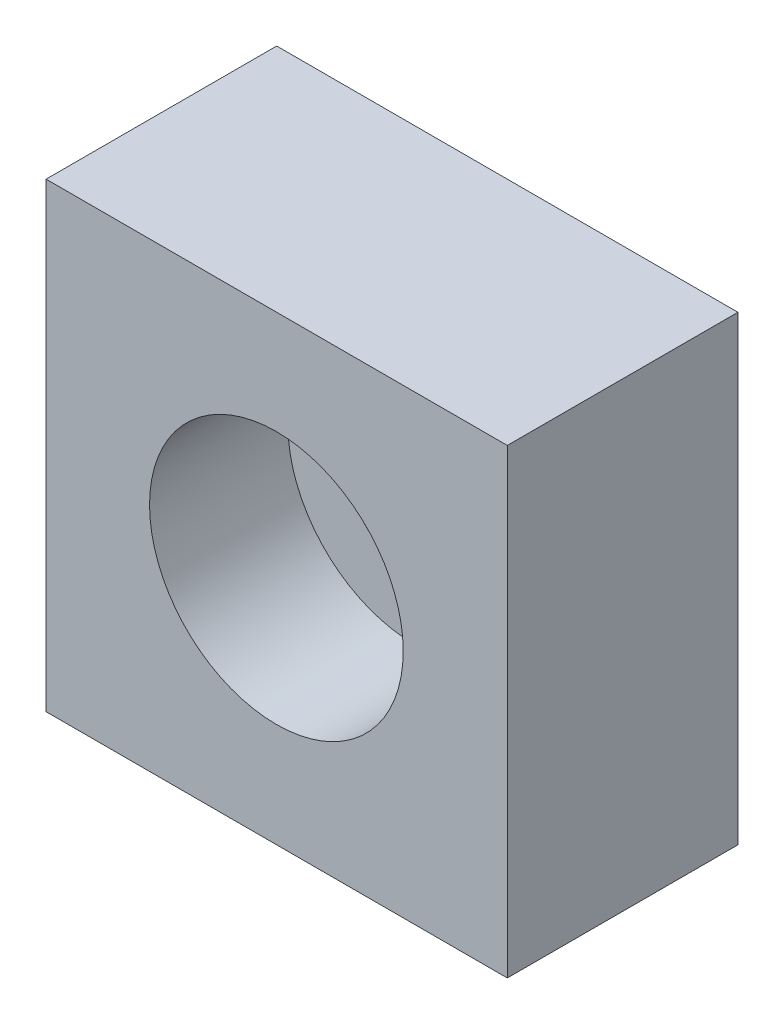
from build123d import *

# Parameters (mm, degrees)
SKETCH_1_W                             = 20
SKETCH_1_H                             = 20
BASEBOX_DEPTH                          = 10
HOLE_BLINDCBORE_THRU_DEPTH_D           = 6
HOLE_BLINDCBORE_THRU_DEPTH_CBORE_D     = 11
HOLE_BLINDCBORE_THRU_DEPTH_CBORE_DEPTH = 6


with BuildPart() as part:
    # 草图1 → BaseBox (new body)
    with BuildSketch(Plane.XY):
        with Locations((10, 10)):
            Rectangle(SKETCH_1_W, SKETCH_1_H)
    extrude(amount=BASEBOX_DEPTH)

    # Hole_BlindCbore_thru_depth (through all)
    with Locations(Plane.XY.offset(10)):
        with Locations((9.986487375, 10.014305599)):
            CounterBoreHole(HOLE_BLINDCBORE_THRU_DEPTH_D / 2, HOLE_BLINDCBORE_THRU_DEPTH_CBORE_D / 2, HOLE_BLINDCBORE_THRU_DEPTH_CBORE_DEPTH)


solid = part.part
